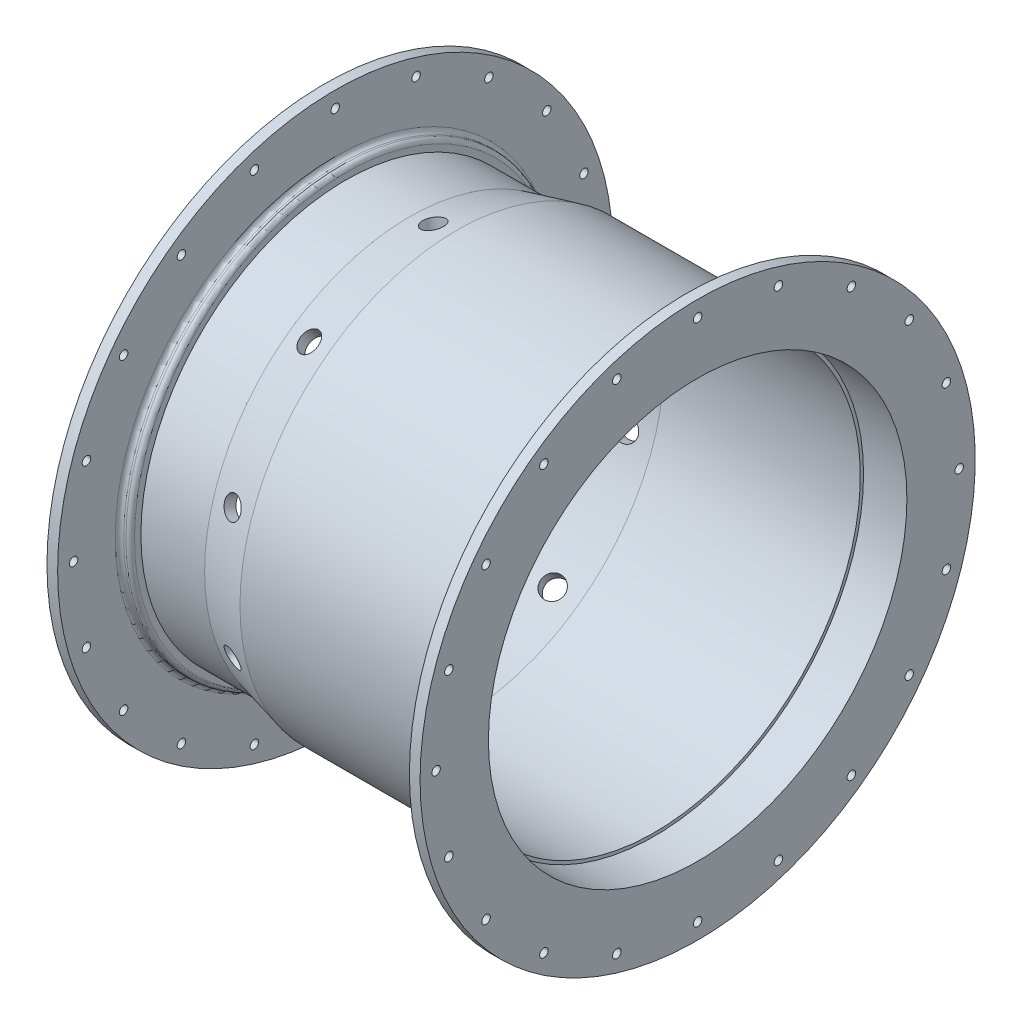
from build123d import *

# Parameters (mm, degrees)
CIRPATTERN2_COUNT  = 10
SKETCH3_R          = 2
CUT_EXTRUDE1_DEPTH = 254.648501868
CIRPATTERN3_COUNT  = 20
FILLET1_R          = 2


with BuildPart() as part:
    # Sketch1 → Revolve1 (revolve)
    with BuildSketch(Plane.XY, mode=Mode.PRIVATE) as revolve1_sk:
        Polygon((112.25, 130), (107.25, 130), (107.25, 101.5), (-0.614444284, 101.5), (-22.654444284, 96), (-52.5, 96), (-52.5, 101), (-57.5, 101), (-57.5, 130), (-62.5, 130), (-62.5, 97), (-57.5, 97), (-57.5, 85), (-42.3, 85), (-42.3, 91), (-22.04, 91), (0, 96.5), (91.95, 96.5), (91.95, 98), (112.25, 98), align=None)
    revolve(revolve1_sk.sketch.rotate(Axis((-81.001285347, 0, 0), (1, 0, 0)), 90), axis=Axis((-81.001285347, 0, 0), (1, 0, 0)))

    # Sketch2 → Cut-Revolve1 (revolve, cut)
    with BuildSketch(Plane.XY, mode=Mode.PRIVATE) as cut_revolve1_sk:
        Polygon((-12.269850531, 102.353567898), (-17.193889296, 101.485327009), (-15.002613193, 89.05798268), (-10.078574428, 89.926223569), align=None)
    cut_revolve1 = revolve(cut_revolve1_sk.sketch.rotate(Axis((-11.634444284, 98.75, 0), (-0.17364817766693144, 0.9848077530122079, 0)), 319.251321456), axis=Axis((-11.634444284, 98.75, 0), (-0.17364817766693144, 0.9848077530122079, 0)), mode=Mode.SUBTRACT)

    # CirPattern2: Cut-Revolve1 ×10 about axis
    cirpattern2_axis = Axis((-57.5, 0, 0), (-1, 0, 0))
    for i in range(1, CIRPATTERN2_COUNT):
        add(cut_revolve1.rotate(cirpattern2_axis, i * 360 / CIRPATTERN2_COUNT), mode=Mode.SUBTRACT)

    # Sketch3 → Cut-Extrude1 (cut, through all)
    with BuildSketch(Plane.ZY.offset(62.5)):
        with Locations((0, 122.5)):
            Circle(SKETCH3_R)
    cut_extrude1 = extrude(amount=-CUT_EXTRUDE1_DEPTH, mode=Mode.SUBTRACT)

    # CirPattern3: Cut-Extrude1 ×20 about axis
    cirpattern3_axis = Axis((0, 0, 0), (1, 0, 0))
    for i in range(1, CIRPATTERN3_COUNT):
        add(cut_extrude1.rotate(cirpattern3_axis, i * 360 / CIRPATTERN3_COUNT), mode=Mode.SUBTRACT)

    # Fillet1
    fillet1_edges = [part.edges().sort_by_distance(p)[0] for p in [
        (107.25, 0, -101.5),
        (-52.5, 0, -101),
        (-57.5, 0, -101),
    ]]
    fillet(fillet1_edges, radius=FILLET1_R)


solid = part.part
